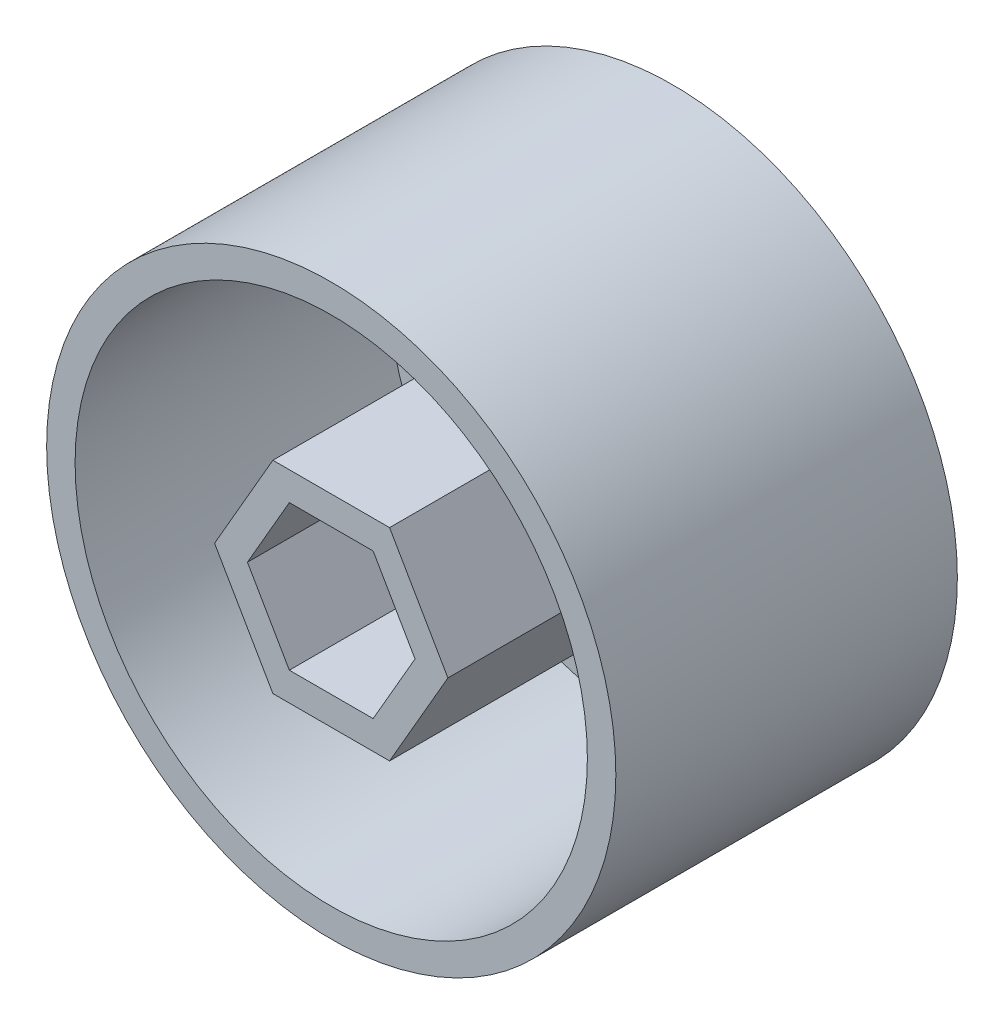
from build123d import *

# Parameters (mm, degrees)
SKETCH_1_R        = 20
SKETCH_1_R_2      = 18
EXTRUDE_1_DEPTH   = 24
EXTRUDE_1_2_DEPTH = 24
SKETCH_2_R        = 20
EXTRUDE_2_DEPTH   = 2


with BuildPart() as part:
    # 草图1 → 凸台-拉伸1 (new body)
    with BuildSketch(Plane.XY):
        Circle(SKETCH_1_R)
        Circle(SKETCH_1_R_2, mode=Mode.SUBTRACT)
    extrude(amount=EXTRUDE_1_DEPTH)



with BuildPart() as body_2:
    # 草图1 → Extrude 1 2 (new body)
    with BuildSketch(Plane.XY):
        Polygon((4.099186911, -7.1), (8.198373822, 0), (4.099186911, 7.1), (-4.099186911, 7.1), (-8.198373822, 0), (-4.099186911, -7.1), align=None)
        Polygon((2.944486373, -5.1), (5.888972746, 0), (2.944486373, 5.1), (-2.944486373, 5.1), (-5.888972746, 0), (-2.944486373, -5.1), align=None, mode=Mode.SUBTRACT)
    extrude(amount=EXTRUDE_1_2_DEPTH)


with BuildPart() as part_1:
    add(part.part)

    add(body_2.part)  # 凸台-拉伸2 merges body 2
    # 草图2 → 凸台-拉伸2 (add)
    with BuildSketch(Plane(origin=(0, 0, 0), x_dir=(-1, 0, 0), z_dir=(0, 0, -1))):
        with Locations(Location((0, 0, 0), (0, 0, 180))):
            Circle(SKETCH_2_R)
        Polygon((2.944486373, 5.1), (5.888972746, 0), (2.944486373, -5.1), (-2.944486373, -5.1), (-5.888972746, 0), (-2.944486373, 5.1), align=None, mode=Mode.SUBTRACT)
    extrude(amount=-EXTRUDE_2_DEPTH)


solid = part_1.part
